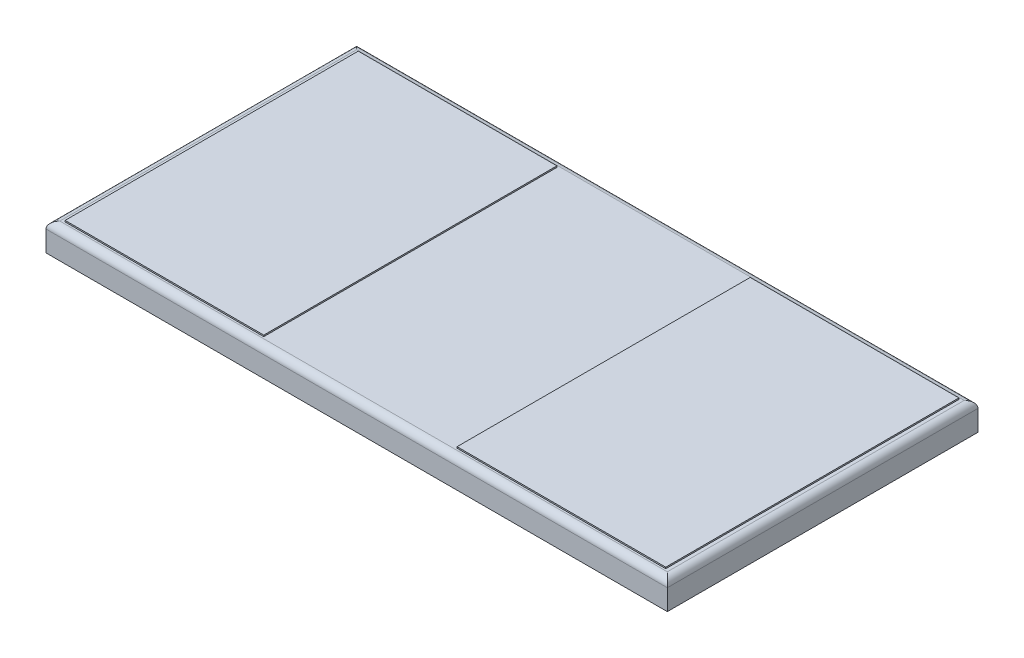
from build123d import *

# Parameters (mm, degrees)
SKETCH1_W           = 2286
SKETCH1_H           = 1143
BOSS_EXTRUDE1_DEPTH = 101.6
SKETCH2_W           = 730.915860416
SKETCH2_H           = 1078.506958481
SKETCH2_W_2         = 767.684139584
CUT_EXTRUDE1_DEPTH  = 88.9
SKETCH3_W           = 730.915860416
SKETCH3_H           = 1078.506958481
SKETCH3_W_2         = 767.684139584
BOSS_EXTRUDE2_DEPTH = 93.98
FILLET1_R           = 25.4


with BuildPart() as part:
    # Sketch1 → Boss-Extrude1 (new body)
    with BuildSketch(Plane(origin=(0, 0, 0), x_dir=(1, 0, 0), z_dir=(0, 1, 0))):
        with Locations((1143, 571.5)):
            Rectangle(SKETCH1_W, SKETCH1_H)
    extrude(amount=BOSS_EXTRUDE1_DEPTH)

    # Sketch2 → Cut-Extrude1 (cut)
    with BuildSketch(Plane(origin=(0, 101.6, 0), x_dir=(1, 0, 0), z_dir=(0, 1, 0))):
        with Locations((403.557930208, 571.468483779)):
            Rectangle(SKETCH2_W, SKETCH2_H)
        with Locations((1864.057930208, 571.468483779)):
            Rectangle(SKETCH2_W_2, SKETCH2_H)
    extrude(amount=-CUT_EXTRUDE1_DEPTH, mode=Mode.SUBTRACT)

    # Sketch3 → Boss-Extrude2 (add)
    with BuildSketch(Plane(origin=(0, 12.7, 0), x_dir=(1, 0, 0), z_dir=(0, 1, 0))):
        with Locations((403.557930208, 571.468483779)):
            Rectangle(SKETCH3_W, SKETCH3_H)
        with Locations((1864.057930208, 571.468483779)):
            Rectangle(SKETCH3_W_2, SKETCH3_H)
    extrude(amount=BOSS_EXTRUDE2_DEPTH)

    # Fillet1
    fillet1_edges = [part.edges().sort_by_distance(p)[0] for p in [
        (2286, 101.6, -571.5),
        (1143, 101.6, -1143),
        (0, 101.6, -571.5),
        (1143, 101.6, 0),
    ]]
    fillet(fillet1_edges, radius=FILLET1_R)


solid = part.part
